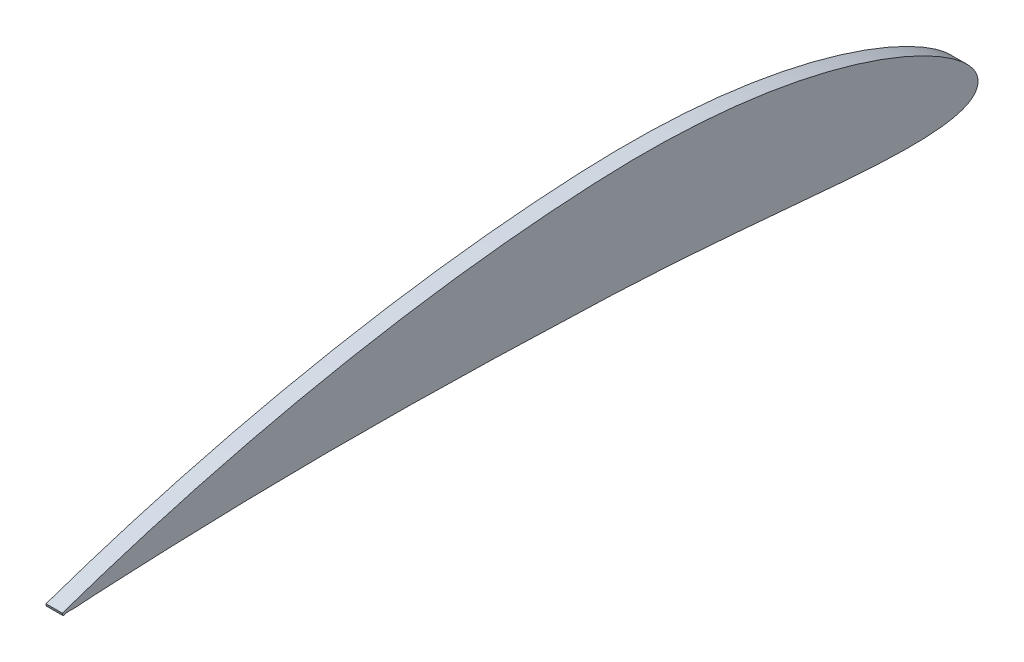
from build123d import *

# Parameters (mm, degrees)
BOSS_EXTRUDE1_DEPTH      = 3.175
BOSS_EXTRUDE1_DEPTH_BACK = 3.175


with BuildPart() as part:
    # Sketch1 → Boss-Extrude1 (new, two sides: drawn at the far end of the back side and taken through both)
    with BuildSketch(Plane(origin=(0, 0, 0), x_dir=(0, 0, -1), z_dir=(1, 0, 0)).offset(-BOSS_EXTRUDE1_DEPTH_BACK)):
        with BuildLine():
            Line((-354.787327228, -0.030257196), (-354.876173011, 0.410417887))
            add(Edge.make_bspline(
                [(-354.876173011, 0.410417887), (-354.559877309, 0.519388), (-353.29965963, 0.95355787), (-350.47872665, 1.927095868), (-345.800950265, 3.497798274), (-336.024074692, 6.721551148), (-319.654473712, 11.798891927), (-300.598349456, 17.130600639), (-282.422876264, 21.724272526), (-261.175777938, 26.651569731), (-238.622276389, 31.145528798), (-208.774809213, 36.004755717), (-183.96165787, 39.090454058), (-158.902335219, 41.113212891), (-140.096691022, 42.111376668), (-121.516747473, 42.228858195), (-103.422167262, 41.321050632), (-86.188408528, 39.478676181), (-70.043450957, 36.810480574), (-55.199760436, 33.432905997), (-41.843390777, 29.510854383), (-30.130463623, 25.220125297), (-20.187014188, 20.73431935), (-12.107203154, 16.226289935), (-5.926897661, 11.855341958), (-1.679224073, 7.716499794), (0.765838065, 3.796757813), (0.987487677, -0.148325216), (-1.35108726, -3.308943186), (-5.450780885, -5.288085739), (-11.087315968, -6.587464624), (-18.34911979, -7.268527656), (-27.163826626, -7.404874951), (-37.447057223, -7.053797092), (-49.083078017, -6.301866785), (-61.95239395, -5.238034817), (-75.929862643, -3.983911698), (-96.406736552, -2.153555858), (-117.937239158, -0.458414508), (-140.484776897, 0.674535203), (-158.296467959, 1.286744043), (-176.48388462, 1.917893193), (-200.671973719, 2.586246563), (-224.541124114, 2.979106232), (-247.830237405, 3.028480659), (-264.337268621, 2.907447598), (-279.933149694, 2.656365926), (-294.437996632, 2.282890374), (-307.681856469, 1.852126627), (-319.513378006, 1.371074809), (-329.767358246, 0.912902227), (-338.388880463, 0.426846955), (-345.076973543, 0.191518705), (-350.227621538, -0.406394891), (-352.780150329, -0.035387827), (-354.744619464, -0.75811662), (-354.777220059, -0.20251155), (-354.787327228, -0.030257196)],
                knots=[0, 0, 0, 0, 0.001371577, 0.005464776, 0.012234802, 0.021601969, 0.04767125, 0.082496261, 0.102719149, 0.124527079, 0.171912573, 0.19697838, 0.248496767, 0.274385101, 0.300041178, 0.325689988, 0.350525088, 0.374279703, 0.396711254, 0.417576734, 0.436654006, 0.45374439, 0.468679994, 0.481329415, 0.491630702, 0.499615789, 0.505546281, 0.510184984, 0.514824194, 0.520701508, 0.52851604, 0.538465752, 0.550542609, 0.564643256, 0.580638139, 0.598344876, 0.617584458, 0.638174401, 0.682632113, 0.706120665, 0.730727383, 0.755700244, 0.780731769, 0.829932396, 0.853570292, 0.876213105, 0.897609987, 0.917519394, 0.935698347, 0.951942678, 0.966047159, 0.97783994, 0.987174002, 0.993931501, 0.998018399, 0.999385644, 1, 1, 1, 1], degree=3))
        make_face()
    extrude(amount=BOSS_EXTRUDE1_DEPTH + BOSS_EXTRUDE1_DEPTH_BACK)


solid = part.part
